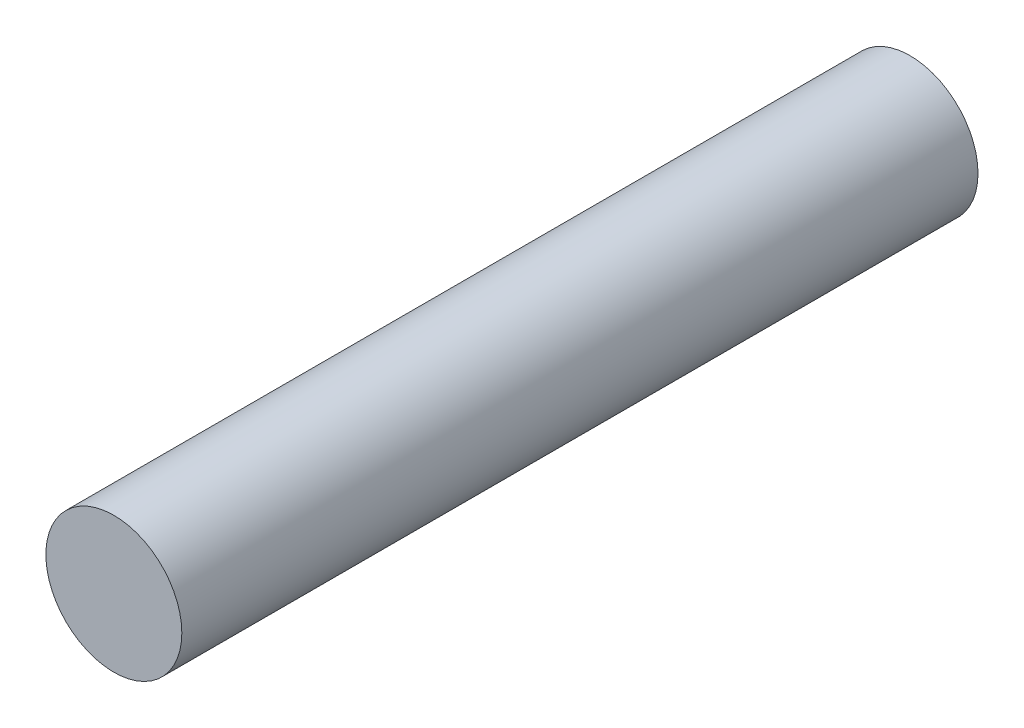
from build123d import *

# Parameters (mm, degrees)
SKETCH_1_R      = 11.1
EXTRUDE_1_DEPTH = 65


with BuildPart() as part:
    # 草圖1 → 伸長1 (new, symmetric)
    with BuildSketch(Plane.XY):
        Circle(SKETCH_1_R)
    extrude(amount=EXTRUDE_1_DEPTH, both=True)


solid = part.part
